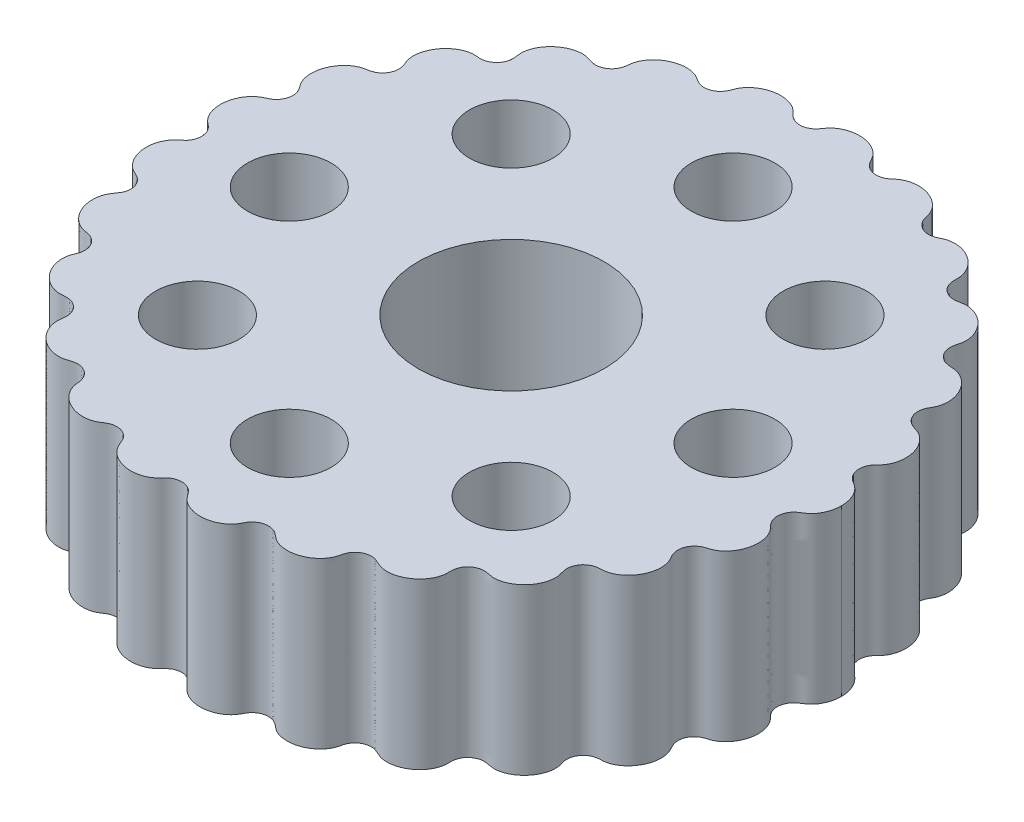
from build123d import *

# Parameters (mm, degrees)
SKETCH2_R           = 9
SKETCH2_R_2         = 4.05
BOSS_EXTRUDE1_DEPTH = 16


with BuildPart() as part:
    # Sketch2 → Boss-Extrude1 (new body)
    with BuildSketch(Plane(origin=(0, 0, 0), x_dir=(1, 0, 0), z_dir=(0, 1, 0))):
        with BuildLine():
            add(Edge.make_bspline(
                [(32, 0), (32, 0.104552358), (31.995829451, 0.244657697), (31.963435541, 0.497350885), (31.943165068, 0.619932859), (31.901921604, 0.805687418), (31.852763503, 0.982893959), (31.760589105, 1.245804684), (31.627237125, 1.522797118), (31.469006514, 1.779878649), (31.31803398, 1.972256305), (31.188685155, 2.110042638), (31.087760031, 2.205033557), (30.999896394, 2.277793706), (30.927586617, 2.332015187), (30.871350264, 2.371443405), (30.808959787, 2.412466941), (30.751215593, 2.448323807), (30.692536259, 2.483902194), (30.642070525, 2.514002994), (30.559019534, 2.565809092), (30.469377484, 2.623038145), (30.321527715, 2.737539285), (30.176012226, 2.87155243), (29.903186515, 3.199909949), (29.700236638, 3.88091016), (29.818309838, 4.486409565), (29.981846047, 4.790286455), (30.090970345, 4.944247467), (30.174602618, 5.045909435), (30.244053455, 5.122786368), (30.311532103, 5.192651079), (30.357458159, 5.238896609), (30.401172941, 5.283216118), (30.443609981, 5.327751389), (30.493548535, 5.383032963), (30.539132758, 5.436666299), (30.596386497, 5.508393758), (30.662356637, 5.59974277), (30.736452975, 5.717426065), (30.804511184, 5.841985833), (30.88687092, 6.016733348), (30.973207507, 6.25001351), (31.047548585, 6.54721012), (31.091258139, 6.856419859), (31.107870152, 7.278384279), (31.049891116, 7.811823412), (30.858103265, 8.428743619), (30.604284316, 8.897432259), (30.353358647, 9.229411907), (30.144291632, 9.452912411), (29.955708119, 9.614738773), (29.799107461, 9.727251873), (29.679319526, 9.802888313), (29.557565985, 9.869588689), (29.455588889, 9.917292551), (29.370396404, 9.952254529), (29.304219556, 9.977077554), (29.232725718, 10.001492534), (29.174448039, 10.019646818), (29.108818527, 10.039159146), (29.039840557, 10.059223914), (28.931074648, 10.095014684), (28.833939514, 10.12764053), (28.652968136, 10.209892793), (28.422601311, 10.336760503), (28.019143955, 10.711051676), (27.761965661, 11.354332894), (27.789507141, 11.891036077), (27.872210385, 12.163811792), (27.935251935, 12.315347049), (27.985501376, 12.417480739), (28.024991396, 12.491719403), (28.069478358, 12.570632791), (28.102908706, 12.628110137), (28.137872268, 12.688330118), (28.16720965, 12.740503156), (28.199361547, 12.801997666), (28.229499493, 12.864308613), (28.266797357, 12.948101553), (28.308366222, 13.054879474), (28.350623015, 13.187611315), (28.396712271, 13.370662905), (28.435043025, 13.611892847), (28.448908857, 13.915240836), (28.430019045, 14.223703271), (28.361500215, 14.638188145), (28.196911243, 15.147181141), (27.883300663, 15.712495129), (27.538603021, 16.121393258), (27.223639197, 16.398310016), (26.971817219, 16.577434962), (26.70806789, 16.725352803), (26.48337612, 16.819944917), (26.303628632, 16.877405045), (26.169148264, 16.911363392), (26.058524802, 16.931910053), (25.967118107, 16.944379376), (25.896640853, 16.951812934), (25.820780348, 16.957565886), (25.759838565, 16.960490442), (25.687870544, 16.963224576), (25.611963101, 16.965502659), (25.489490972, 16.975098019), (25.383984875, 16.981519113), (25.145326791, 17.031127471), (24.835451868, 17.124405366), (24.306622456, 17.505424518), (24.006772445, 18.090477487), (23.958888188, 18.54041876), (23.986174406, 18.852722797), (24.019341529, 18.987870492), (24.041791153, 19.084745189), (24.064644506, 19.167384363), (24.0819528, 19.22894454), (24.100111084, 19.293474134), (24.115170355, 19.350473225), (24.130897605, 19.418203946), (24.144392609, 19.48596123), (24.159450449, 19.576415232), (24.172868415, 19.69022445), (24.180449364, 19.829400722), (24.179433235, 19.971159189), (24.166529181, 20.163619714), (24.12851506, 20.410452193), (24.04922974, 20.706447101), (23.900019675, 21.095357266), (23.636415258, 21.559161528), (23.214511254, 22.048446483), (22.792528515, 22.379942389), (22.426260546, 22.588784498), (22.141240505, 22.714946241), (21.849177495, 22.809134729), (21.607677319, 22.858570104), (21.416097434, 22.880750301), (21.273531459, 22.888737815), (21.133916591, 22.887914443), (21.024423737, 22.880226916), (20.935791712, 22.86954177), (20.864722965, 22.85871337), (20.786771796, 22.844665842), (20.71172915, 22.829472252), (20.64801582, 22.81589924), (20.584655507, 22.802234305), (20.485954003, 22.782237117), (20.367126511, 22.765318386), (20.239852319, 22.751878016), (20.031705243, 22.752803226), (19.649405243, 22.788057775), (18.99695204, 23.155474298), (18.683045888, 23.649276833), (18.576999258, 24.003400837), (18.542947223, 24.264963722), (18.542038835, 24.379953398), (18.540471611, 24.480242724), (18.542125383, 24.560748635), (18.543546065, 24.622458483), (18.544952615, 24.687004458), (18.545224364, 24.745260226), (18.543444351, 24.814872527), (18.539495143, 24.883749828), (18.531356095, 24.975074492), (18.515760874, 25.088604193), (18.488125739, 25.225325382), (18.439348183, 25.408045878), (18.35551971, 25.637927337), (18.220248765, 25.910028689), (17.998328957, 26.257815909), (17.647679345, 26.657159234), (17.135653066, 27.049771614), (16.557822492, 27.336905777), (16.04693625, 27.475590363), (15.636646997, 27.521420751), (15.335050356, 27.522743408), (15.094105128, 27.49627747), (14.907486189, 27.458883387), (14.772655382, 27.42305117), (14.668854132, 27.388188029), (14.585603762, 27.355523076), (14.519125436, 27.327024128), (14.446456924, 27.293556372), (14.376454812, 27.259514284), (14.317280659, 27.230103106), (14.254656829, 27.198715648), (14.154486214, 27.151231004), (14.034088631, 27.102668269), (13.892770518, 27.054813028), (13.686947093, 27.006403395), (13.417853903, 26.989316109), (13.124928173, 27.015651045), (12.788162751, 27.123824548), (12.41504024, 27.347559735), (12.132565973, 27.669159892), (11.994348736, 27.93802664), (11.916726351, 28.145426441), (11.892224449, 28.240319139), (11.866457856, 28.336544683), (11.843448669, 28.43534006), (11.824275636, 28.518203576), (11.807258137, 28.585187034), (11.788032612, 28.652210347), (11.766942716, 28.717792178), (11.73613561, 28.804129704), (11.692518151, 28.910120224), (11.631400502, 29.03560249), (11.561487633, 29.159226768), (11.456493063, 29.321497293), (11.303240919, 29.518991483), (11.090015554, 29.739484208), (10.850490688, 29.940278512), (10.500724898, 30.177969534), (10.017333975, 30.411108368), (9.392606592, 30.574859819), (8.86092084, 30.607546875), (8.447263288, 30.570142354), (8.146290078, 30.510728768), (7.911901544, 30.436850188), (7.733785647, 30.363178187), (7.605241298, 30.300850442), (7.483713121, 30.232318108), (7.392503104, 30.172830588), (7.320512529, 30.120545555), (7.263056491, 30.076024441), (7.200067505, 30.024540042), (7.138660525, 29.972287994), (7.086727071, 29.927530675), (7.031720853, 29.879828087), (6.94090797, 29.805117671), (6.820127723, 29.718028275), (6.663332456, 29.623351764), (6.445519985, 29.520781956), (6.114639536, 29.443538745), (5.770234806, 29.433760046), (5.429192546, 29.506762984), (5.075008606, 29.663900398), (4.78655184, 29.901702244), (4.632643231, 30.093772498), (4.529362244, 30.248291254), (4.487511116, 30.324426182), (4.440149383, 30.409684374), (4.395658965, 30.495331792), (4.357661876, 30.568364645), (4.324725402, 30.628290693), (4.289268366, 30.688382982), (4.252432226, 30.746486342), (4.200932969, 30.822314162), (4.132071606, 30.913981866), (4.041325111, 31.020183723), (3.909657973, 31.156411303), (3.724406661, 31.316891638), (3.473806746, 31.489230646), (3.2015031, 31.636571454), (2.813155882, 31.797834138), (2.293861385, 31.927612853), (1.648335843, 31.960761658), (1.119117793, 31.884683923), (0.718177773, 31.764062431), (0.433164002, 31.645086009), (0.169041284, 31.499796056), (-0.029248737, 31.359336599), (-0.172745424, 31.237103685), (-0.272264793, 31.140999533), (-0.347260485, 31.058664567), (-0.40619946, 30.987319842), (-0.450589957, 30.930201606), (-0.497422389, 30.866266443), (-0.535053614, 30.812405615), (-0.583002141, 30.742117582), (-0.641591045, 30.659879606), (-0.705089649, 30.574443023), (-0.812063159, 30.451455819), (-0.95414326, 30.308788221), (-1.291204409, 30.064797549), (-1.921437869, 29.883088279), (-2.604055919, 30.034725204), (-2.864349975, 30.204247318), (-3.025324795, 30.323205512), (-3.141204593, 30.431071036), (-3.225827409, 30.519267585), (-3.2768809, 30.576403617), (-3.32301601, 30.62749775), (-3.377885056, 30.687681556), (-3.434185364, 30.747028742), (-3.485712586, 30.798635942), (-3.534505119, 30.844550412), (-3.599624604, 30.901881479), (-3.688258956, 30.972409145), (-3.804154709, 31.053225098), (-3.926984857, 31.128291644), (-4.097813375, 31.219342883), (-4.3261079, 31.316899207), (-4.621365038, 31.406633148), (-5.030249238, 31.485750614), (-5.563956761, 31.507476112), (-6.202335393, 31.40843171), (-6.706362739, 31.226125908), (-7.077531333, 31.025674392), (-7.334835805, 30.850883417), (-7.568068893, 30.653566443), (-7.73849844, 30.473764174), (-7.857480134, 30.324059251), (-7.938297602, 30.208687048), (-8.010521424, 30.090598793), (-8.063927448, 29.989382375), (-8.10286703, 29.906256496), (-8.130426685, 29.842178682), (-8.155649541, 29.778238292), (-8.184617038, 29.699706255), (-8.218914024, 29.606963544), (-8.255828698, 29.515425257), (-8.289967176, 29.430125653), (-8.381806632, 29.249424652), (-8.531447485, 29.021223138), (-8.870410945, 28.681835585), (-9.412579797, 28.462738515), (-9.840772647, 28.449255096), (-10.143099065, 28.492896224), (-10.373654501, 28.5739999), (-10.51525633, 28.642384151), (-10.62025223, 28.699820116), (-10.719259891, 28.761104534), (-10.791301322, 28.809244151), (-10.852197536, 28.850276522), (-10.907573969, 28.886627288), (-10.974975589, 28.92870045), (-11.037242517, 28.965166592), (-11.097926545, 28.998304811), (-11.177851626, 29.038667441), (-11.281171615, 29.084660653), (-11.412716102, 29.133525963), (-11.595366869, 29.188955611), (-11.835372407, 29.239348854), (-12.137832435, 29.268250792), (-12.551808204, 29.263796112), (-13.076032332, 29.177491747), (-13.680503351, 28.950752021), (-14.229519782, 28.612857161), (-14.617856053, 28.252172594), (-14.872351575, 27.929880026), (-15.033084646, 27.673953316), (-15.137690115, 27.455934483), (-15.203281151, 27.28019499), (-15.243520907, 27.147799824), (-15.269793182, 27.036430751), (-15.286630314, 26.946063132), (-15.297209043, 26.877215464), (-15.305673656, 26.808190255), (-15.314376755, 26.72222192), (-15.325242045, 26.618467787), (-15.338994693, 26.519295493), (-15.353024673, 26.41413076), (-15.410494366, 26.180616229), (-15.536145383, 25.86975663), (-15.863491876, 25.424068148), (-16.525348201, 25.090742198), (-16.980998181, 25.077695738), (-17.212740064, 25.106674661), (-17.340060887, 25.135357302), (-17.447145005, 25.163817494), (-17.550652637, 25.197117676), (-17.62665401, 25.223938844), (-17.692177692, 25.247209589), (-17.755124241, 25.268615591), (-17.830061255, 25.29217431), (-17.899226895, 25.31177389), (-17.966108963, 25.32856231), (-18.053598475, 25.347550377), (-18.165327315, 25.366145809), (-18.305033543, 25.380426623), (-18.448176274, 25.386284952), (-18.642549624, 25.382793011), (-18.890732711, 25.357084815), (-19.191613393, 25.292393544), (-19.489149311, 25.195192808), (-19.875954058, 25.024110528), (-20.329932993, 24.73718179), (-20.799471288, 24.29392149), (-21.108368554, 23.860061031), (-21.295099053, 23.489955621), (-21.403091687, 23.204477476), (-21.464656385, 22.964841454), (-21.495837947, 22.776554232), (-21.510363448, 22.636679983), (-21.516056587, 22.498493639), (-21.513519932, 22.384103894), (-21.507113733, 22.292281501), (-21.500076557, 22.223055506), (-21.492395517, 22.164976744), (-21.482689727, 22.099911831), (-21.473390394, 22.037779338), (-21.461358093, 21.955536547), (-21.45079303, 21.85623011), (-21.436007456, 21.730345042), (-21.44205944, 21.444272273), (-21.521034233, 21.040950355), (-21.835153403, 20.49661963), (-22.41747634, 20.12458118), (-22.772343383, 20.053507022), (-22.975784009, 20.033892713), (-23.076062757, 20.033750884), (-23.175622143, 20.035207603), (-23.27466881, 20.041550562), (-23.354639544, 20.048446028), (-23.427575102, 20.055107295), (-23.488779033, 20.059830836), (-23.564907303, 20.063752745), (-23.635883426, 20.065290751), (-23.705157527, 20.064694891), (-23.795683678, 20.061020357), (-23.909017744, 20.050931788), (-24.047586563, 20.029745237), (-24.233838438, 19.989507141), (-24.468929754, 19.916670243), (-24.747671685, 19.794984602), (-25.017462083, 19.641344197), (-25.35996528, 19.396955615), (-25.745133482, 19.024789848), (-26.11493807, 18.494636808), (-26.330247972, 18.005707608), (-26.439917212, 17.601887695), (-26.489407587, 17.298236552), (-26.505617724, 16.996702842), (-26.491149336, 16.755804803), (-26.463096435, 16.57065071), (-26.433913642, 16.435505779), (-26.402736363, 16.325433757), (-26.3734265, 16.238020883), (-26.349277844, 16.172881248), (-26.326975315, 16.11786001), (-26.30033194, 16.05492813), (-26.275002652, 15.99493891), (-26.241028828, 15.913281139), (-26.207158422, 15.820207458), (-26.152654232, 15.677288572), (-26.086348597, 15.33885827), (-26.098548623, 14.84378517), (-26.379720748, 14.225231963), (-26.847679333, 13.843923261), (-27.115940338, 13.73214623), (-27.325372306, 13.663719981), (-27.426924415, 13.643963731), (-27.543383279, 13.620596313), (-27.616272475, 13.609099769), (-27.68554536, 13.597674077), (-27.745620119, 13.587053434), (-27.81987775, 13.57181754), (-27.911763238, 13.550108263), (-28.020863545, 13.518940084), (-28.149471339, 13.473051038), (-28.278419883, 13.417696614), (-28.406164633, 13.353362493), (-28.574643289, 13.255686438), (-28.779766518, 13.112220908), (-29.011276161, 12.909728094), (-29.295572145, 12.603520029), (-29.596329541, 12.162331767), (-29.850363761, 11.56796874), (-29.962331369, 11.044148093), (-29.988572145, 10.623487155), (-29.97631191, 10.313172346), (-29.932145484, 10.011400015), (-29.869651348, 9.77236049), (-29.805530854, 9.592989833), (-29.750329088, 9.463905132), (-29.688168249, 9.340486456), (-29.630358534, 9.241780663), (-29.579937046, 9.164387885), (-29.540308231, 9.107515444), (-29.504305338, 9.059069929), (-29.461192579, 9.002591865), (-29.420076683, 8.948787958), (-29.364453679, 8.873536745), (-29.316452262, 8.805406688), (-29.24793868, 8.700121478), (-29.161098202, 8.543720365), (-29.039298221, 8.251055457), (-28.970092342, 7.678170433), (-29.198157639, 7.020137073), (-29.536746189, 6.659473093), (-29.73223209, 6.521093053), (-29.886010146, 6.429361509), (-29.977943506, 6.384368226), (-30.077647775, 6.337664893), (-30.141874637, 6.309769041), (-30.202997727, 6.282869038), (-30.258578677, 6.257447741), (-30.326162142, 6.224316753), (-30.409443108, 6.180346623), (-30.507121682, 6.122831868), (-30.62020937, 6.046027371), (-30.731216679, 5.95999784), (-30.87468741, 5.834108144), (-31.045038735, 5.655999012), (-31.22980472, 5.414051508), (-31.445084778, 5.060038692), (-31.649493929, 4.568971214), (-31.777074644, 3.936038571), (-31.780240814, 3.398829292), (-31.72070374, 2.979746612), (-31.645712821, 2.675365403), (-31.541463867, 2.38551111), (-31.409855068, 2.115408768), (-31.279845564, 1.911399076), (-31.165208893, 1.762962948), (-31.075105966, 1.660287079), (-30.995312996, 1.580412134), (-30.925785281, 1.517014824), (-30.868848792, 1.46814433), (-30.82073627, 1.429010807), (-30.770479245, 1.38943718), (-30.718233641, 1.348667372), (-30.640449805, 1.28548124), (-30.564173169, 1.220568786), (-30.460292855, 1.120060377), (-30.337831544, 0.987535241), (-30.198120503, 0.773343684), (-30.105340046, 0.578043453), (-30.04555615, 0.391295977), (-30.009102278, 0.196773807), (-30, 0.062633005), (-30, 0)],
                knots=[0.072083776, 0.072083776, 0.072083776, 0.072083776, 0.075437288, 0.077114043, 0.078790799, 0.080467554, 0.08214431, 0.085497821, 0.088851332, 0.092204844, 0.095558355, 0.097235111, 0.098911866, 0.100588622, 0.101427, 0.102265377, 0.103103755, 0.103942133, 0.104361322, 0.104780511, 0.1051997, 0.105618889, 0.105828483, 0.106038077, 0.106247672, 0.106457266, 0.106666861, 0.106876455, 0.10708605, 0.107295644, 0.107714833, 0.108134022, 0.108553211, 0.1089724, 0.109810778, 0.110649155, 0.111487533, 0.112325911, 0.114002667, 0.115679422, 0.117356178, 0.119032933, 0.122386445, 0.125739956, 0.129093467, 0.132446978, 0.139154001, 0.145861023, 0.152568046, 0.155921557, 0.159275068, 0.162628579, 0.164305335, 0.165982091, 0.167658846, 0.169335602, 0.17017398, 0.171012357, 0.171850735, 0.172689113, 0.173108302, 0.173527491, 0.17394668, 0.174365869, 0.174575463, 0.174785057, 0.174994652, 0.175204246, 0.175413841, 0.175623435, 0.17583303, 0.176042624, 0.176461813, 0.176881002, 0.177300191, 0.17771938, 0.178557758, 0.179396135, 0.180234513, 0.181072891, 0.182749647, 0.184426402, 0.186103158, 0.189456669, 0.19281018, 0.196163692, 0.199517203, 0.206224225, 0.212931248, 0.21963827, 0.222991781, 0.226345292, 0.229698804, 0.233052315, 0.234729071, 0.236405826, 0.238082582, 0.23892096, 0.239759337, 0.240597715, 0.241436093, 0.241855282, 0.242274471, 0.24269366, 0.243112849, 0.243322443, 0.243532037, 0.243741632, 0.243951226, 0.244160821, 0.244370415, 0.244789604, 0.245208793, 0.245627982, 0.246047171, 0.24646636, 0.247304738, 0.248143115, 0.248981493, 0.249819871, 0.251496627, 0.253173382, 0.254850138, 0.256526893, 0.259880405, 0.263233916, 0.266587427, 0.27329445, 0.280001472, 0.286708494, 0.290062006, 0.293415517, 0.296769028, 0.300122539, 0.301799295, 0.303476051, 0.305152806, 0.306829562, 0.30766794, 0.308506317, 0.309344695, 0.310183073, 0.310602262, 0.311021451, 0.31144064, 0.311650234, 0.311859829, 0.312069423, 0.312279017, 0.312488612, 0.312698206, 0.312907801, 0.313117395, 0.313536584, 0.313955773, 0.314374962, 0.314794151, 0.31521334, 0.316051718, 0.316890095, 0.317728473, 0.318566851, 0.320243607, 0.321920362, 0.323597118, 0.326950629, 0.33030414, 0.333657652, 0.340364674, 0.347071696, 0.353778719, 0.360485741, 0.363839252, 0.367192764, 0.370546275, 0.372223031, 0.373899786, 0.375576542, 0.37641492, 0.377253297, 0.378091675, 0.378930053, 0.379349242, 0.379768431, 0.38018762, 0.380397214, 0.380606809, 0.380816403, 0.3809212, 0.381025997, 0.381130795, 0.381235592, 0.381445186, 0.381654781, 0.381864375, 0.382283564, 0.382702753, 0.383121942, 0.38396032, 0.384798698, 0.385637075, 0.386475453, 0.387313831, 0.388990587, 0.390667342, 0.392344098, 0.394020853, 0.397374365, 0.400727876, 0.404081387, 0.407434898, 0.414141921, 0.420848943, 0.427555966, 0.430909477, 0.434262988, 0.437616499, 0.439293255, 0.440970011, 0.442646766, 0.444323522, 0.4451619, 0.446000277, 0.446838655, 0.447677033, 0.448096222, 0.448515411, 0.4489346, 0.449144194, 0.449353789, 0.449563383, 0.44966818, 0.449772977, 0.449877775, 0.449982572, 0.450192166, 0.450401761, 0.450611355, 0.451030544, 0.451449733, 0.451868922, 0.4527073, 0.453545678, 0.454384055, 0.455222433, 0.456060811, 0.457737567, 0.459414322, 0.461091078, 0.464444589, 0.4677981, 0.471151612, 0.474505123, 0.481212145, 0.487919168, 0.49462619, 0.497979701, 0.501333212, 0.504686724, 0.508040235, 0.509716991, 0.511393746, 0.513070502, 0.51390888, 0.514747257, 0.515585635, 0.516424013, 0.516843202, 0.517262391, 0.51768158, 0.517891174, 0.518100769, 0.518310363, 0.518519957, 0.518729552, 0.518939146, 0.519148741, 0.519358335, 0.519777524, 0.520196713, 0.520615902, 0.52145428, 0.522292658, 0.523131035, 0.523969413, 0.524807791, 0.526484547, 0.528161302, 0.529838058, 0.531514813, 0.534868325, 0.538221836, 0.541575347, 0.54828237, 0.554989392, 0.561696414, 0.565049926, 0.568403437, 0.571756948, 0.575110459, 0.576787215, 0.578463971, 0.580140726, 0.581817482, 0.58265586, 0.583494237, 0.584332615, 0.585170993, 0.585590182, 0.586009371, 0.58642856, 0.586638154, 0.586847749, 0.587057343, 0.587266937, 0.587371735, 0.587476532, 0.587686126, 0.587895721, 0.588105315, 0.588524504, 0.588943693, 0.589362882, 0.59020126, 0.591039638, 0.591878015, 0.592716393, 0.593554771, 0.595231527, 0.596908282, 0.598585038, 0.601938549, 0.60529206, 0.608645572, 0.615352594, 0.622059616, 0.628766639, 0.635473661, 0.638827172, 0.642180684, 0.645534195, 0.647210951, 0.648887706, 0.650564462, 0.65140284, 0.652241217, 0.653079595, 0.653917973, 0.654337162, 0.654756351, 0.65517554, 0.655385134, 0.655594729, 0.655804323, 0.656013917, 0.656223512, 0.656433106, 0.656642701, 0.656852295, 0.657271484, 0.657690673, 0.658109862, 0.65894824, 0.659786618, 0.660624995, 0.661463373, 0.662301751, 0.663978507, 0.665655262, 0.667332018, 0.669008773, 0.672362285, 0.675715796, 0.679069307, 0.682422818, 0.689129841, 0.695836863, 0.702543886, 0.705897397, 0.709250908, 0.712604419, 0.714281175, 0.715957931, 0.717634686, 0.719311442, 0.72014982, 0.720988197, 0.721826575, 0.722245764, 0.722664953, 0.723084142, 0.723503331, 0.72392252, 0.724132114, 0.724341709, 0.724551303, 0.724760897, 0.724970492, 0.725180086, 0.725389681, 0.725599275, 0.726018464, 0.726437653, 0.726856842, 0.72769522, 0.728533598, 0.729371975, 0.730210353, 0.731048731, 0.732725487, 0.734402242, 0.736078998, 0.739432509, 0.74278602, 0.746139532, 0.749493043, 0.756200065, 0.762907088, 0.76961411, 0.772967621, 0.776321132, 0.779674644, 0.783028155, 0.784704911, 0.786381666, 0.788058422, 0.7888968, 0.789735177, 0.790573555, 0.790992744, 0.791411933, 0.791831122, 0.792250311, 0.7926695, 0.792879094, 0.793088689, 0.793298283, 0.793507877, 0.793717472, 0.793927066, 0.794346255, 0.794765444, 0.795184633, 0.795603822, 0.7964422, 0.797280578, 0.798118955, 0.799795711, 0.801472467, 0.803149222, 0.804825978, 0.806502733, 0.809856245, 0.813209756, 0.816563267, 0.82327029, 0.829977312, 0.836684334, 0.840037846, 0.843391357, 0.846744868, 0.850098379, 0.851775135, 0.853451891, 0.855128646, 0.856805402, 0.85764378, 0.858482157, 0.859320535, 0.859739724, 0.860158913, 0.860578102, 0.860997291, 0.861206885, 0.86141648, 0.861626074, 0.861835669, 0.862045263, 0.862254857, 0.862464452, 0.862674046, 0.863093235, 0.863512424, 0.863931613, 0.864350802, 0.86518918, 0.866027558, 0.866865935, 0.868542691, 0.870219447, 0.871896202, 0.873572958, 0.876926469, 0.88027998, 0.883633492, 0.890340514, 0.897047536, 0.903754559, 0.90710807, 0.910461581, 0.913815092, 0.917168604, 0.920522115, 0.922198871, 0.923875626, 0.925552382, 0.92639076, 0.927229137, 0.928067515, 0.928486704, 0.928905893, 0.929325082, 0.929744271, 0.929953865, 0.93016346, 0.930268257, 0.930373054, 0.930477851, 0.93053025, 0.930582649, 0.930582649, 0.930582649, 0.930582649], degree=3))
            add(Edge.make_bspline(
                [(-30, 0), (-30, -0.062633005), (-30.009102278, -0.196773807), (-30.04555615, -0.391295977), (-30.105340046, -0.578043453), (-30.198120503, -0.773343684), (-30.337831544, -0.987535241), (-30.460292855, -1.120060377), (-30.564173169, -1.220568786), (-30.640449805, -1.28548124), (-30.718233641, -1.348667372), (-30.770479245, -1.389437179), (-30.82073627, -1.429010807), (-30.868848792, -1.46814433), (-30.925785281, -1.517014824), (-30.995312996, -1.580412134), (-31.075105966, -1.660287079), (-31.165208893, -1.762962948), (-31.279845564, -1.911399076), (-31.409855068, -2.115408768), (-31.541463867, -2.38551111), (-31.645712821, -2.675365403), (-31.72070374, -2.979746612), (-31.780240814, -3.398829292), (-31.777074644, -3.936038571), (-31.649493929, -4.568971214), (-31.445084778, -5.060038692), (-31.229804721, -5.414051507), (-31.045038735, -5.655999012), (-30.87468741, -5.834108144), (-30.731216679, -5.95999784), (-30.62020937, -6.046027371), (-30.507121683, -6.122831868), (-30.409443108, -6.180346623), (-30.326162142, -6.224316753), (-30.258578677, -6.257447741), (-30.202997727, -6.282869038), (-30.141874637, -6.309769041), (-30.077647776, -6.337664893), (-29.977943507, -6.384368226), (-29.886010147, -6.429361508), (-29.732232092, -6.521093052), (-29.536746193, -6.659473091), (-29.198157645, -7.020137064), (-28.970092342, -7.678170423), (-29.039298219, -8.25105545), (-29.1610982, -8.543720362), (-29.247938679, -8.700121476), (-29.316452262, -8.805406688), (-29.364453678, -8.873536744), (-29.420076683, -8.948787957), (-29.461192579, -9.002591864), (-29.504305338, -9.059069929), (-29.540308231, -9.107515443), (-29.579937045, -9.164387884), (-29.630358534, -9.241780662), (-29.688168249, -9.340486456), (-29.750329088, -9.463905132), (-29.805530854, -9.592989833), (-29.869651348, -9.77236049), (-29.932145484, -10.011400015), (-29.97631191, -10.313172346), (-29.988572145, -10.623487154), (-29.962331369, -11.044148092), (-29.850363761, -11.56796874), (-29.596329541, -12.162331767), (-29.295572146, -12.603520029), (-29.011276162, -12.909728094), (-28.779766518, -13.112220907), (-28.574643289, -13.255686437), (-28.406164633, -13.353362492), (-28.278419884, -13.417696613), (-28.14947134, -13.473051038), (-28.020863546, -13.518940084), (-27.911763238, -13.550108263), (-27.81987775, -13.57181754), (-27.745620119, -13.587053434), (-27.685545361, -13.597674077), (-27.616272476, -13.609099769), (-27.54338328, -13.620596313), (-27.426924417, -13.64396373), (-27.325372308, -13.66371998), (-27.115940345, -13.732146228), (-26.847679345, -13.843923256), (-26.379720762, -14.225231945), (-26.098548626, -14.843785151), (-26.086348596, -15.338858259), (-26.152654231, -15.677288567), (-26.207158422, -15.820207456), (-26.241028828, -15.913281137), (-26.275002652, -15.994938908), (-26.30033194, -16.054928129), (-26.326975314, -16.117860009), (-26.349277843, -16.172881247), (-26.3734265, -16.238020882), (-26.402736363, -16.325433757), (-26.433913642, -16.435505779), (-26.463096435, -16.57065071), (-26.491149336, -16.755804802), (-26.505617724, -16.996702841), (-26.489407587, -17.298236551), (-26.439917213, -17.601887695), (-26.330247972, -18.005707608), (-26.11493807, -18.494636807), (-25.745133482, -19.024789847), (-25.359965281, -19.396955614), (-25.017462084, -19.641344197), (-24.747671686, -19.794984602), (-24.468929755, -19.916670243), (-24.233838439, -19.989507141), (-24.047586564, -20.029745237), (-23.909017744, -20.050931788), (-23.795683679, -20.061020357), (-23.705157528, -20.064694891), (-23.635883427, -20.065290751), (-23.564907304, -20.063752745), (-23.488779034, -20.059830836), (-23.427575103, -20.055107295), (-23.354639546, -20.048446028), (-23.274668812, -20.041550562), (-23.175622147, -20.035207603), (-23.07606276, -20.033750884), (-22.975784016, -20.033892713), (-22.772343395, -20.05350702), (-22.417476363, -20.124581172), (-21.835153426, -20.496619605), (-21.52103424, -21.040950331), (-21.442059441, -21.44427226), (-21.436007455, -21.730345036), (-21.45079303, -21.856230108), (-21.461358093, -21.955536545), (-21.473390394, -22.037779336), (-21.482689727, -22.099911829), (-21.492395517, -22.164976744), (-21.500076557, -22.223055505), (-21.507113733, -22.2922815), (-21.513519932, -22.384103893), (-21.516056587, -22.498493639), (-21.510363448, -22.636679982), (-21.495837947, -22.776554231), (-21.464656385, -22.964841453), (-21.403091688, -23.204477475), (-21.295099053, -23.48995562), (-21.108368555, -23.86006103), (-20.799471289, -24.293921489), (-20.329932994, -24.737181789), (-19.875954059, -25.024110527), (-19.489149312, -25.195192808), (-19.191613395, -25.292393543), (-18.890732712, -25.357084815), (-18.642549625, -25.382793011), (-18.448176275, -25.386284952), (-18.305033544, -25.380426624), (-18.165327316, -25.366145809), (-18.053598476, -25.347550377), (-17.966108964, -25.32856231), (-17.899226896, -25.31177389), (-17.830061256, -25.29217431), (-17.755124243, -25.268615591), (-17.692177693, -25.247209589), (-17.626654012, -25.223938845), (-17.550652639, -25.197117677), (-17.44714501, -25.163817495), (-17.340060893, -25.135357303), (-17.212740075, -25.106674663), (-16.980998198, -25.07769574), (-16.525348242, -25.090742189), (-15.863491907, -25.42406812), (-15.536145396, -25.869756605), (-15.41049437, -26.180616215), (-15.353024674, -26.414130754), (-15.338994694, -26.51929549), (-15.325242046, -26.618467784), (-15.314376755, -26.722221918), (-15.305673657, -26.808190254), (-15.297209043, -26.877215463), (-15.286630315, -26.946063131), (-15.269793182, -27.03643075), (-15.243520908, -27.147799823), (-15.203281151, -27.280194989), (-15.137690115, -27.455934482), (-15.033084646, -27.673953315), (-14.872351576, -27.929880025), (-14.617856054, -28.252172594), (-14.229519783, -28.61285716), (-13.680503352, -28.950752021), (-13.076032333, -29.177491746), (-12.551808206, -29.263796111), (-12.137832437, -29.268250792), (-11.835372408, -29.239348854), (-11.59536687, -29.188955611), (-11.412716103, -29.133525963), (-11.281171617, -29.084660654), (-11.177851627, -29.038667441), (-11.097926546, -28.998304812), (-11.037242519, -28.965166592), (-10.97497559, -28.928700451), (-10.90757397, -28.886627288), (-10.852197537, -28.850276523), (-10.791301324, -28.809244152), (-10.719259895, -28.761104536), (-10.620252235, -28.699820119), (-10.515256337, -28.642384155), (-10.373654517, -28.573999907), (-10.143099091, -28.492896232), (-9.840772689, -28.449255099), (-9.412579853, -28.462738503), (-8.87041098, -28.681835558), (-8.531447503, -29.021223115), (-8.38180664, -29.249424639), (-8.289967178, -29.430125647), (-8.2558287, -29.515425254), (-8.218914025, -29.606963541), (-8.184617039, -29.699706253), (-8.155649542, -29.778238291), (-8.130426686, -29.842178681), (-8.10286703, -29.906256494), (-8.063927449, -29.989382374), (-8.010521425, -30.090598792), (-7.938297603, -30.208687047), (-7.857480134, -30.32405925), (-7.738498441, -30.473764173), (-7.568068894, -30.653566442), (-7.334835806, -30.850883416), (-7.077531335, -31.025674391), (-6.70636274, -31.226125907), (-6.202335394, -31.40843171), (-5.563956762, -31.507476112), (-5.03024924, -31.485750615), (-4.621365039, -31.406633149), (-4.326107902, -31.316899208), (-4.097813377, -31.219342884), (-3.926984859, -31.128291645), (-3.804154711, -31.053225099), (-3.688258957, -30.972409146), (-3.599624605, -30.90188148), (-3.53450512, -30.844550413), (-3.485712588, -30.798635943), (-3.434185366, -30.747028743), (-3.377885057, -30.687681558), (-3.323016012, -30.627497752), (-3.276880901, -30.576403619), (-3.225827413, -30.519267589), (-3.141204598, -30.431071042), (-3.025324806, -30.323205522), (-2.864349993, -30.20424733), (-2.604055958, -30.034725224), (-1.921437944, -29.883088277), (-1.291204451, -30.064797524), (-0.95414328, -30.308788203), (-0.812063168, -30.451455809), (-0.705089654, -30.574443018), (-0.641591049, -30.659879601), (-0.583002143, -30.742117579), (-0.535053615, -30.812405614), (-0.497422391, -30.866266441), (-0.450589958, -30.930201604), (-0.406199461, -30.987319841), (-0.347260487, -31.058664565), (-0.272264794, -31.140999532), (-0.172745425, -31.237103684), (-0.029248738, -31.359336598), (0.169041283, -31.499796055), (0.433164001, -31.645086009), (0.718177771, -31.764062431), (1.119117791, -31.884683923), (1.648335841, -31.960761658), (2.293861383, -31.927612853), (2.81315588, -31.797834139), (3.201503099, -31.636571455), (3.473806745, -31.489230647), (3.72440666, -31.316891639), (3.909657971, -31.156411304), (4.04132511, -31.020183724), (4.132071605, -30.913981867), (4.200932968, -30.822314164), (4.252432225, -30.746486344), (4.289268365, -30.688382984), (4.324725401, -30.628290695), (4.357661875, -30.568364647), (4.395658963, -30.495331795), (4.440149381, -30.409684379), (4.487511113, -30.324426186), (4.52936224, -30.248291261), (4.632643219, -30.093772514), (4.786551815, -29.901702271), (5.075008561, -29.663900428), (5.42919248, -29.506763006), (5.770234728, -29.433760053), (6.114639469, -29.443538735), (6.44551995, -29.520781942), (6.663332434, -29.623351753), (6.820127711, -29.718028266), (6.940907963, -29.805117666), (7.031720848, -29.879828083), (7.086727069, -29.927530673), (7.138660523, -29.972287992), (7.200067503, -30.02454004), (7.263056489, -30.07602444), (7.320512527, -30.120545554), (7.392503103, -30.172830587), (7.483713119, -30.232318107), (7.605241297, -30.300850441), (7.733785645, -30.363178186), (7.911901542, -30.436850188), (8.146290075, -30.510728768), (8.447263286, -30.570142354), (8.860920837, -30.607546876), (9.39260659, -30.57485982), (10.017333973, -30.411108369), (10.500724896, -30.177969535), (10.850490686, -29.940278514), (11.090015552, -29.73948421), (11.303240917, -29.518991485), (11.456493061, -29.321497295), (11.561487632, -29.159226769), (11.631400501, -29.035602492), (11.69251815, -28.910120226), (11.73613561, -28.804129706), (11.766942716, -28.71779218), (11.788032611, -28.652210349), (11.807258136, -28.585187036), (11.824275635, -28.518203579), (11.843448669, -28.435340063), (11.866457854, -28.336544689), (11.892224448, -28.240319145), (11.916726348, -28.145426452), (11.994348726, -27.938026664), (12.132565945, -27.669159936), (12.415040189, -27.347559782), (12.788162672, -27.123824584), (13.12492809, -27.015651061), (13.417853843, -26.989316109), (13.686947056, -27.006403388), (13.892770495, -27.054813021), (14.034088618, -27.102668264), (14.154486205, -27.151231), (14.254656824, -27.198715645), (14.317280656, -27.230103105), (14.376454809, -27.259514283), (14.446456922, -27.293556371), (14.519125433, -27.327024127), (14.58560376, -27.355523075), (14.66885413, -27.388188028), (14.77265538, -27.423051169), (14.907486186, -27.458883387), (15.094105126, -27.496277469), (15.335050354, -27.522743408), (15.636646994, -27.521420752), (16.046936248, -27.475590364), (16.55782249, -27.336905778), (17.135653064, -27.049771616), (17.647679343, -26.657159236), (17.998328955, -26.257815912), (18.220248764, -25.910028692), (18.355519709, -25.637927339), (18.439348183, -25.40804588), (18.488125739, -25.225325385), (18.515760874, -25.088604196), (18.531356095, -24.975074494), (18.539495142, -24.883749831), (18.54344435, -24.814872529), (18.545224364, -24.745260229), (18.544952615, -24.687004461), (18.543546065, -24.622458487), (18.542125383, -24.560748639), (18.540471611, -24.480242731), (18.542038834, -24.379953404), (18.542947222, -24.264963738), (18.576999252, -24.003400873), (18.683045863, -23.649276896), (18.996951968, -23.155474369), (19.649405159, -22.788057796), (20.03170521, -22.752803226), (20.239852295, -22.751878015), (20.367126498, -22.765318384), (20.485953992, -22.782237115), (20.584655501, -22.802234304), (20.648015816, -22.815899239), (20.711729147, -22.829472251), (20.786771793, -22.844665842), (20.864722962, -22.85871337), (20.93579171, -22.86954177), (21.024423735, -22.880226916), (21.133916589, -22.887914443), (21.273531456, -22.888737815), (21.416097432, -22.880750301), (21.607677316, -22.858570104), (21.849177493, -22.809134729), (22.141240502, -22.714946242), (22.426260543, -22.588784499), (22.792528513, -22.379942391), (23.214511252, -22.048446485), (23.636415257, -21.55916153), (23.900019673, -21.095357268), (24.049229739, -20.706447104), (24.128515059, -20.410452196), (24.16652918, -20.163619717), (24.179433235, -19.971159192), (24.180449364, -19.829400725), (24.172868416, -19.690224452), (24.159450449, -19.576415235), (24.144392609, -19.485961232), (24.130897605, -19.418203949), (24.115170355, -19.350473228), (24.100111085, -19.293474137), (24.081952801, -19.228944544), (24.064644507, -19.167384368), (24.041791155, -19.084745196), (24.01934153, -18.987870499), (23.98617441, -18.852722817), (23.95888819, -18.540418809), (24.006772424, -18.090477574), (24.30662238, -17.505424604), (24.835451801, -17.124405393), (25.145326755, -17.03112748), (25.383984861, -16.981519114), (25.489490962, -16.97509802), (25.611963094, -16.965502659), (25.687870539, -16.963224576), (25.759838562, -16.960490442), (25.820780345, -16.957565886), (25.896640851, -16.951812934), (25.967118104, -16.944379376), (26.0585248, -16.931910053), (26.169148262, -16.911363393), (26.30362863, -16.877405046), (26.483376117, -16.819944918), (26.708067887, -16.725352805), (26.971817217, -16.577434963), (27.223639194, -16.398310018), (27.538603019, -16.12139326), (27.883300661, -15.712495132), (28.196911242, -15.147181144), (28.361500214, -14.638188148), (28.430019044, -14.223703274), (28.448908857, -13.915240839), (28.435043025, -13.61189285), (28.396712271, -13.370662908), (28.350623016, -13.187611318), (28.308366223, -13.054879477), (28.266797358, -12.948101555), (28.229499494, -12.864308615), (28.199361548, -12.801997669), (28.167209651, -12.740503159), (28.13787227, -12.688330121), (28.102908709, -12.628110141), (28.069478361, -12.570632796), (28.0249914, -12.491719412), (27.98550138, -12.417480746), (27.935251944, -12.315347067), (27.872210397, -12.163811825), (27.789507155, -11.891036143), (27.761965648, -11.354333002), (28.019143884, -10.711051774), (28.42260126, -10.336760535), (28.652968106, -10.209892809), (28.833939503, -10.127640533), (28.931074637, -10.095014688), (29.03984055, -10.059223916), (29.108818522, -10.039159147), (29.174448036, -10.019646819), (29.232725715, -10.001492536), (29.304219553, -9.977077555), (29.370396402, -9.952254531), (29.455588886, -9.917292552), (29.557565983, -9.86958869), (29.679319523, -9.802888315), (29.799107458, -9.727251874), (29.955708116, -9.614738775), (30.144291629, -9.452912414), (30.353358645, -9.22941191), (30.604284314, -8.897432262), (30.858103264, -8.428743622), (31.049891115, -7.811823416), (31.107870152, -7.278384283), (31.091258139, -6.856419863), (31.047548586, -6.547210124), (30.973207508, -6.250013513), (30.886870922, -6.016733351), (30.804511185, -5.841985836), (30.736452976, -5.717426068), (30.662356639, -5.599742773), (30.596386499, -5.508393761), (30.53913276, -5.436666301), (30.493548537, -5.383032966), (30.443609983, -5.327751391), (30.401172944, -5.28321612), (30.357458163, -5.238896613), (30.311532108, -5.192651084), (30.244053463, -5.122786377), (30.174602624, -5.045909442), (30.090970361, -4.944247487), (29.981846071, -4.790286492), (29.818309873, -4.48640965), (29.700236634, -3.880910289), (29.903186453, -3.199910053), (30.176012193, -2.87155246), (30.32152769, -2.737539307), (30.469377472, -2.623038152), (30.559019524, -2.565809099), (30.64207052, -2.514002997), (30.692536254, -2.483902197), (30.751215589, -2.448323809), (30.808959784, -2.412466943), (30.871350261, -2.371443407), (30.927586615, -2.332015189), (30.999896392, -2.277793709), (31.087760028, -2.205033559), (31.188685153, -2.11004264), (31.318033978, -1.972256308), (31.469006512, -1.779878652), (31.627237123, -1.522797122), (31.760589104, -1.245804688), (31.852763502, -0.982893963), (31.901921603, -0.805687422), (31.943165067, -0.619932862), (31.96343554, -0.49735089), (31.995829451, -0.244657699), (32, -0.104552359), (32, 0)],
                knots=[0.072083776, 0.072083776, 0.072083776, 0.072083776, 0.072136175, 0.072188574, 0.072293371, 0.072398168, 0.072502965, 0.07271256, 0.072922154, 0.073341343, 0.073760532, 0.074179721, 0.07459891, 0.075437288, 0.076275665, 0.077114043, 0.078790799, 0.080467554, 0.08214431, 0.085497821, 0.088851333, 0.092204844, 0.095558355, 0.098911866, 0.105618889, 0.112325911, 0.119032933, 0.122386445, 0.125739956, 0.129093467, 0.130770223, 0.132446978, 0.134123734, 0.13580049, 0.136638867, 0.137477245, 0.138315623, 0.138734812, 0.139154001, 0.13957319, 0.139992379, 0.140201973, 0.140411568, 0.140621162, 0.140830756, 0.141040351, 0.141249945, 0.14145954, 0.141669134, 0.142088323, 0.142507512, 0.142926701, 0.14334589, 0.144184268, 0.145022645, 0.145861023, 0.147537779, 0.149214534, 0.15089129, 0.152568046, 0.155921557, 0.159275068, 0.162628579, 0.165982091, 0.172689113, 0.179396135, 0.186103158, 0.189456669, 0.19281018, 0.196163692, 0.197840447, 0.199517203, 0.201193958, 0.202870714, 0.20454747, 0.205385847, 0.206224225, 0.207062603, 0.207481792, 0.207900981, 0.20832017, 0.208739359, 0.208948953, 0.209158548, 0.209368142, 0.209577736, 0.209787331, 0.209996925, 0.210416114, 0.210835303, 0.211254492, 0.211673681, 0.21209287, 0.212931248, 0.213769625, 0.214608003, 0.216284759, 0.217961514, 0.21963827, 0.222991781, 0.226345293, 0.229698804, 0.233052315, 0.239759337, 0.24646636, 0.253173382, 0.256526893, 0.259880405, 0.263233916, 0.266587427, 0.268264183, 0.269940938, 0.271617694, 0.272456072, 0.27329445, 0.274132827, 0.274971205, 0.275809583, 0.276228772, 0.276647961, 0.27706715, 0.277276744, 0.277486339, 0.277695933, 0.277905528, 0.278115122, 0.278324716, 0.278534311, 0.278743905, 0.279163094, 0.279582283, 0.280001472, 0.280420661, 0.28083985, 0.281678228, 0.282516605, 0.283354983, 0.285031739, 0.286708494, 0.28838525, 0.290062006, 0.293415517, 0.296769028, 0.300122539, 0.306829562, 0.313536584, 0.320243607, 0.323597118, 0.326950629, 0.33030414, 0.333657652, 0.335334407, 0.337011163, 0.338687918, 0.340364674, 0.341203052, 0.34204143, 0.342879807, 0.343718185, 0.344556563, 0.344975752, 0.345394941, 0.34581413, 0.346023724, 0.346233319, 0.346442913, 0.346652508, 0.346862102, 0.347071696, 0.347281291, 0.347490885, 0.347910074, 0.348329263, 0.348748452, 0.34958683, 0.350425208, 0.351263585, 0.352101963, 0.353778719, 0.355455474, 0.35713223, 0.360485741, 0.363839253, 0.367192764, 0.373899786, 0.380606809, 0.387313831, 0.394020853, 0.397374365, 0.400727876, 0.404081387, 0.405758143, 0.407434898, 0.409111654, 0.409950032, 0.41078841, 0.411626787, 0.412465165, 0.413303543, 0.413722732, 0.414141921, 0.41456111, 0.414770704, 0.414980299, 0.415189893, 0.41529469, 0.415399488, 0.415609082, 0.415818676, 0.416028271, 0.416237865, 0.416657054, 0.417076243, 0.417495432, 0.41833381, 0.419172188, 0.420010565, 0.420848943, 0.422525699, 0.424202454, 0.42587921, 0.427555966, 0.430909477, 0.434262988, 0.437616499, 0.440970011, 0.447677033, 0.454384055, 0.461091078, 0.464444589, 0.4677981, 0.471151612, 0.472828367, 0.474505123, 0.476181878, 0.477858634, 0.478697012, 0.47953539, 0.480373767, 0.481212145, 0.482050523, 0.482469712, 0.482888901, 0.48330809, 0.483517684, 0.483727279, 0.483936873, 0.484146468, 0.484356062, 0.484565656, 0.484775251, 0.484984845, 0.485404034, 0.485823223, 0.486242412, 0.48708079, 0.487919168, 0.488757545, 0.489595923, 0.491272679, 0.492949434, 0.49462619, 0.497979701, 0.501333213, 0.504686724, 0.508040235, 0.514747257, 0.52145428, 0.528161302, 0.531514813, 0.534868325, 0.538221836, 0.541575347, 0.543252103, 0.544928858, 0.546605614, 0.547443992, 0.54828237, 0.549120747, 0.549959125, 0.550797503, 0.551216692, 0.551635881, 0.55205507, 0.552264664, 0.552474259, 0.552683853, 0.55278865, 0.552893448, 0.552998245, 0.553103042, 0.553312636, 0.553522231, 0.553731825, 0.554151014, 0.554570203, 0.554989392, 0.55582777, 0.556666148, 0.557504525, 0.558342903, 0.560019659, 0.561696414, 0.56337317, 0.565049926, 0.568403437, 0.571756948, 0.575110459, 0.581817482, 0.588524504, 0.595231527, 0.598585038, 0.601938549, 0.60529206, 0.608645572, 0.610322327, 0.611999083, 0.613675838, 0.615352594, 0.616190972, 0.61702935, 0.617867727, 0.618706105, 0.619544483, 0.619963672, 0.620382861, 0.62080205, 0.621011644, 0.621221239, 0.621430833, 0.62153563, 0.621640427, 0.621745225, 0.621850022, 0.622059616, 0.622269211, 0.622478805, 0.622897994, 0.623317183, 0.623736372, 0.62457475, 0.625413128, 0.626251505, 0.627089883, 0.628766639, 0.630443394, 0.63212015, 0.635473661, 0.638827172, 0.642180684, 0.648887706, 0.655594729, 0.662301751, 0.669008773, 0.672362285, 0.675715796, 0.679069307, 0.680746063, 0.682422818, 0.684099574, 0.684937952, 0.68577633, 0.686614707, 0.687453085, 0.687872274, 0.688291463, 0.688710652, 0.689129841, 0.68954903, 0.689758624, 0.689968219, 0.690177813, 0.690387407, 0.690597002, 0.690806596, 0.691016191, 0.691225785, 0.691644974, 0.692064163, 0.692483352, 0.69332173, 0.694160108, 0.694998485, 0.695836863, 0.697513619, 0.699190374, 0.70086713, 0.702543886, 0.705897397, 0.709250908, 0.712604419, 0.715957931, 0.722664953, 0.729371975, 0.736078998, 0.739432509, 0.74278602, 0.746139532, 0.747816287, 0.749493043, 0.751169798, 0.752846554, 0.753684932, 0.75452331, 0.755361687, 0.756200065, 0.756619254, 0.757038443, 0.757457632, 0.757876821, 0.75829601, 0.758505604, 0.758715199, 0.758924793, 0.759134387, 0.759343982, 0.759553576, 0.759972765, 0.760391954, 0.760811143, 0.761230332, 0.76206871, 0.762907088, 0.763745465, 0.764583843, 0.766260599, 0.767937354, 0.76961411, 0.772967621, 0.776321132, 0.779674644, 0.783028155, 0.789735177, 0.7964422, 0.803149222, 0.806502733, 0.809856245, 0.813209756, 0.816563267, 0.818240023, 0.819916778, 0.821593534, 0.822431912, 0.82327029, 0.824108667, 0.824947045, 0.825366234, 0.825785423, 0.826204612, 0.826623801, 0.826833395, 0.82704299, 0.827252584, 0.827462179, 0.827671773, 0.827881367, 0.828090962, 0.828300556, 0.828719745, 0.829138934, 0.829558123, 0.829977312, 0.83081569, 0.831654068, 0.832492445, 0.833330823, 0.835007579, 0.836684334, 0.83836109, 0.840037846, 0.843391357, 0.846744868, 0.850098379, 0.856805402, 0.863512424, 0.870219447, 0.873572958, 0.876926469, 0.88027998, 0.883633492, 0.885310247, 0.886987003, 0.888663758, 0.890340514, 0.891178892, 0.89201727, 0.892855647, 0.893694025, 0.894113214, 0.894532403, 0.894951592, 0.895370781, 0.895580375, 0.89578997, 0.895999564, 0.896209159, 0.896418753, 0.896628347, 0.896837942, 0.897047536, 0.897466725, 0.897885914, 0.898305103, 0.898724292, 0.89956267, 0.900401048, 0.901239425, 0.902077803, 0.903754559, 0.905431314, 0.90710807, 0.910461581, 0.913815092, 0.917168604, 0.920522115, 0.922198871, 0.923875626, 0.925552382, 0.927229137, 0.930582649, 0.930582649, 0.930582649, 0.930582649], degree=3))
        make_face()
        with Locations(Location((0, 0, 0), (0, 0, 270))):
            Circle(SKETCH2_R, mode=Mode.SUBTRACT)
        with Locations(Location((0, 21.5, 0), (0, 0, 270))):
            Circle(SKETCH2_R_2, mode=Mode.SUBTRACT)
        with Locations(Location((15.202795796, 15.202795796, 0), (0, 0, 270))):
            Circle(SKETCH2_R_2, mode=Mode.SUBTRACT)
        with Locations(Location((21.5, 0, 0), (0, 0, 270))):
            Circle(SKETCH2_R_2, mode=Mode.SUBTRACT)
        with Locations(Location((15.202795796, -15.202795796, 0), (0, 0, 270))):
            Circle(SKETCH2_R_2, mode=Mode.SUBTRACT)
        with Locations(Location((0, -21.5, 0), (0, 0, 270))):
            Circle(SKETCH2_R_2, mode=Mode.SUBTRACT)
        with Locations(Location((-15.202795796, -15.202795796, 0), (0, 0, 270))):
            Circle(SKETCH2_R_2, mode=Mode.SUBTRACT)
        with Locations(Location((-21.5, 0, 0), (0, 0, 270))):
            Circle(SKETCH2_R_2, mode=Mode.SUBTRACT)
        with Locations(Location((-15.202795796, 15.202795796, 0), (0, 0, 270))):
            Circle(SKETCH2_R_2, mode=Mode.SUBTRACT)
    extrude(amount=BOSS_EXTRUDE1_DEPTH)


solid = part.part
